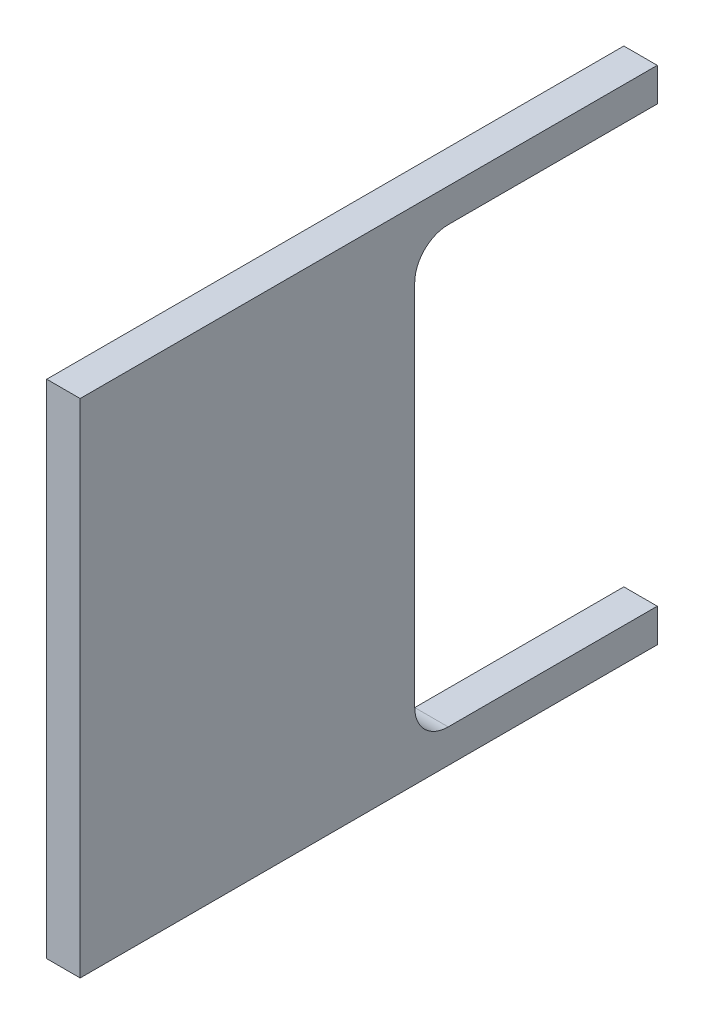
from build123d import *

# Parameters (mm, degrees)
SKETCH1_W           = 219.075
SKETCH1_H           = 190.5
BOSS_EXTRUDE1_DEPTH = 12.7
CUT_EXTRUDE1_REACH  = 147.713
SKETCH2_W           = 92.075
SKETCH2_H           = 165.1
FILLET1_R           = 12.7


with BuildPart() as part:
    # Sketch1 → Boss-Extrude1 (new body)
    with BuildSketch(Plane(origin=(0, 0, 0), x_dir=(0, 0, -1), z_dir=(1, 0, 0))):
        Rectangle(SKETCH1_W, SKETCH1_H)
    extrude(amount=BOSS_EXTRUDE1_DEPTH)

    # Sketch2 → Cut-Extrude1 (cut, up to next)
    with BuildSketch(Plane(origin=(12.7, 0, 0), x_dir=(0, 0, -1), z_dir=(1, 0, 0)), mode=Mode.PRIVATE) as cut_extrude1_sk1:
        with Locations((63.5, 0)):
            Rectangle(SKETCH2_W, SKETCH2_H)
    cut_extrude1_tool1 = extrude(cut_extrude1_sk1.sketch, amount=-CUT_EXTRUDE1_REACH, mode=Mode.PRIVATE) & part.part
    add(cut_extrude1_tool1.solids().sort_by_distance((12.7, 0, -63.5))[0], mode=Mode.SUBTRACT)

    # Fillet1
    fillet1_edges = [part.edges().sort_by_distance(p)[0] for p in [
        (6.35, -82.55, -17.4625),
        (6.35, 82.55, -17.4625),
    ]]
    fillet(fillet1_edges, radius=FILLET1_R)


solid = part.part
